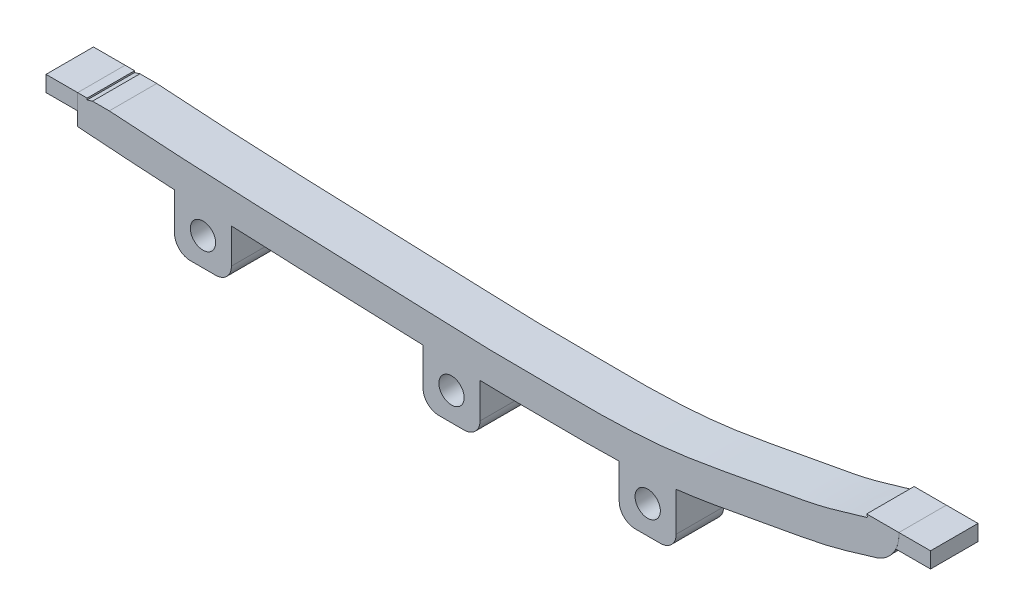
from build123d import *

# Parameters (mm, degrees)
BOSS_EXTRUDE4_DEPTH   = 15
BOSS_EXTRUDE6_DEPTH   = 15
SKETCH9_W             = 10
SKETCH9_H             = 5
BOSS_EXTRUDE6_2_DEPTH = 15
BOSS_EXTRUDE7_DEPTH   = 15
SKETCH10_3_R          = 4
BOSS_EXTRUDE8_DEPTH   = 15


with BuildPart() as part:
    # Sketch7 → Boss-Extrude4 (new body)
    with BuildSketch(Plane(origin=(0, 0, -6), x_dir=(-1, 0, 0), z_dir=(0, 0, -1))):
        with BuildLine():
            add(Edge.make_bspline(
                [(57.2, -13.241438652), (57.940948653, -13.346356469), (64.587142125, -14.249582963), (71.312194486, -14.734985078), (77.511230388, -14.988343975), (78.2, -15.01379053)],
                knots=[0.238034992, 0.238034992, 0.238034992, 0.238034992, 0.246275151, 0.312196429, 0.320436589, 0.320436589, 0.320436589, 0.320436589], degree=3))
            add(Edge.make_bspline(
                [(34.2, -9.211877556), (41.409801763, -10.527206877), (48.791618696, -12.006313762), (56.437988852, -13.1335384), (57.2, -13.241438652)],
                knots=[0.153291014, 0.153291014, 0.153291014, 0.153291014, 0.229560594, 0.238034992, 0.238034992, 0.238034992, 0.238034992], degree=3))
            add(Edge.make_bspline(
                [(10.85, -4.486121303), (11.496747196, -4.663742615), (18.016097792, -6.397161892), (26.844120594, -7.869898375), (34.2, -9.211877556)],
                knots=[0.066830041, 0.066830041, 0.066830041, 0.066830041, 0.075476139, 0.153291014, 0.153291014, 0.153291014, 0.153291014], degree=3))
            add(Edge.make_bspline(
                [(0, -0.35), (-0.483452752, -1.204257993), (1.302042991, -1.648175028), (6.582551453, -3.291551277), (10.421202726, -4.368357307), (10.85, -4.486121303)],
                knots=[0, 0, 0, 0, 0.015238311, 0.061097627, 0.066830041, 0.066830041, 0.066830041, 0.066830041], degree=3))
            Line((0, -0.35), (-10.188216911, -0.35))
            add(Edge.make_bspline(
                [(-10.188216911, -0.35), (-10.197127097, -0.510752936), (-10.216331299, -1.088262475), (-10.151417384, -2.435265781), (-9.675954224, -4.523313959), (-8.530561998, -6.760194321), (-7.075801045, -8.452525785), (-5.679238644, -9.553961654), (-4.134605623, -10.44231148), (-2.880886158, -10.899353539), (-2.150247131, -11.108080139), (-1.99097397, -11.151191222), (-1.743295207, -11.221598169), (-1.397756261, -11.320747763), (-0.898863104, -11.466275116), (-0.223591276, -11.66586298), (0.519660501, -11.887231791), (1.31921711, -12.126191555), (2.448276504, -12.463649443), (3.954159506, -12.911953065), (5.85344771, -13.467978987), (7.76640741, -14.013306986), (9.765908185, -14.555389572), (12.628699413, -15.264549802), (16.351645079, -16.077455835), (21.025045558, -16.990630025), (25.780594099, -17.859563119), (30.50545011, -18.701614623), (35.035354382, -19.530251144), (39.492904564, -20.367600229), (45.401537623, -21.465593589), (51.344923032, -22.501474122), (57.523606347, -23.398956772), (63.56627511, -24.122790279), (69.296485447, -24.591214113), (74.906141504, -24.893682219), (79.129467052, -25.063967779), (83.372818136, -25.161769493), (88.887878389, -25.205095957), (95.617379104, -25.150845956), (103.427870642, -25.090659436), (111.416956976, -25.083478463), (119.66653005, -24.981964106), (127.964146322, -24.706890196), (136.060643619, -24.393165499), (146.702723915, -24.003393297), (159.76888755, -23.534872407), (175.126965002, -22.976435331), (195.267726209, -22.189784525), (215.031454717, -21.270031239), (232.227098133, -20.238260428), (242.049294314, -19.554945574), (246.912434987, -19.212388667), (249.35, -19.041222648)],
                knots=[0.004195794, 0.004195794, 0.004195794, 0.004195794, 0.004450038, 0.005084888, 0.006101866, 0.007118844, 0.008135822, 0.009152799, 0.010169777, 0.012203732, 0.014237688, 0.016271643, 0.018305599, 0.020339554, 0.024407465, 0.028475376, 0.032543286, 0.036611197, 0.040679108, 0.048814929, 0.056950751, 0.065086573, 0.073222394, 0.081358216, 0.097629859, 0.113901502, 0.130173145, 0.146444788, 0.162716432, 0.178988075, 0.195259718, 0.227803004, 0.244074647, 0.260346291, 0.292889577, 0.30916122, 0.325432863, 0.341704506, 0.35797615, 0.390519436, 0.423062722, 0.455606009, 0.488149295, 0.520692581, 0.553235868, 0.585779154, 0.650865727, 0.715952299, 0.781038872, 0.911212017, 0.97629859, 1.008841876, 1.041385163, 1.041385163, 1.041385163, 1.041385163], degree=3))
            Line((249.35, -19.041222648), (249.35, -10.422260297))
            Line((249.35, -10.422260297), (249.35, -9.718799499))
            Line((249.35, -9.718799499), (246.35, -9.718799499))
            Line((246.35, -9.718799499), (246.35, -10.231818509))
            add(Edge.make_bspline(
                [(244.655582362, -9.718799499), (245.221025629, -9.887119027), (245.785839725, -10.058090244), (246.35, -10.231818509)],
                knots=[0.848733006, 0.848733006, 0.848733006, 0.848733006, 0.858409316, 0.858409316, 0.858409316, 0.858409316], degree=3))
            Line((244.655582362, -9.718799499), (239.35, -9.718799499))
            add(Edge.make_bspline(
                [(120.2, -14.937565102), (124.42621276, -14.832580639), (167.021385075, -13.178620512), (205.049851795, -12.127358768), (239.35, -9.718799499)],
                knots=[0.491186429, 0.491186429, 0.491186429, 0.491186429, 0.542067786, 1, 1, 1, 1], degree=3))
            add(Edge.make_bspline(
                [(100.2, -15.114678663), (106.147715502, -15.0776097), (112.777403417, -15.106727027), (119.524444871, -14.954346744), (120.2, -14.937565102)],
                knots=[0.409853179, 0.409853179, 0.409853179, 0.409853179, 0.483053104, 0.491186429, 0.491186429, 0.491186429, 0.491186429], degree=3))
            add(Edge.make_bspline(
                [(78.2, -15.01379053), (78.947405775, -15.041403394), (86.421320399, -15.285687036), (93.661168244, -15.155431741), (100.2, -15.114678663)],
                knots=[0.320436589, 0.320436589, 0.320436589, 0.320436589, 0.329378248, 0.409853179, 0.409853179, 0.409853179, 0.409853179], degree=3))
        make_face()
    extrude(amount=BOSS_EXTRUDE4_DEPTH)

    # Sketch10 → Boss-Extrude7 (add)
    with BuildSketch(Plane.XY.offset(-6)):
        with BuildLine():
            add(Edge.make_bspline(
                [(-60.2, -23.714449378), (-60.813781821, -23.786710968), (-64.414348052, -24.192117154), (-69.296485447, -24.591214113), (-74.596964487, -24.877011645), (-77.101104267, -24.981720215), (-78.2, -25.020602765)],
                knots=[0.253707481, 0.253707481, 0.253707481, 0.253707481, 0.260346291, 0.292889577, 0.30916122, 0.321845607, 0.321845607, 0.321845607, 0.321845607], degree=3))
            Line((-78.2, -25.020602765), (-78.2, -36.01379053))
            ThreePointArc((-78.2, -36.01379053), (-76.735533906, -39.549324436), (-73.2, -41.01379053))
            Line((-73.2, -41.01379053), (-69.2, -41.01379053))
            Line((-69.2, -41.01379053), (-65.2, -41.01379053))
            ThreePointArc((-65.2, -41.01379053), (-61.664466094, -39.549324436), (-60.2, -36.01379053))
            Line((-60.2, -36.01379053), (-60.2, -23.714449378))
        make_face()
        with BuildLine():
            ThreePointArc((-65.2, -32.148166032), (-66.371572875, -34.976593157), (-69.2, -36.148166032))
            ThreePointArc((-69.2, -36.148166032), (-72.028427125, -29.319738908), (-65.2, -32.148166032))
        make_face(mode=Mode.SUBTRACT)
    extrude(amount=-BOSS_EXTRUDE7_DEPTH)

    # Sketch10<3> → Boss-Extrude8 (add)
    # profile 1 of 3: a face of its own
    with BuildSketch(Plane.XY.offset(-6)):
        with BuildLine():
            Line((-78.2, -15.01379053), (-78.2, -36.01379053))
            ThreePointArc((-78.2, -36.01379053), (-76.735533906, -39.549324436), (-73.2, -41.01379053))
            Line((-73.2, -41.01379053), (-65.2, -41.01379053))
            ThreePointArc((-65.2, -41.01379053), (-61.664466094, -39.549324436), (-60.2, -36.01379053))
            Line((-60.2, -36.01379053), (-60.2, -15.01379053))
            Line((-60.2, -15.01379053), (-78.2, -15.01379053))
        make_face()
        with Locations((-69.2, -32.148166032)):
            Circle(SKETCH10_3_R, mode=Mode.SUBTRACT)
    # profile 2 of 3: a face of its own
    with BuildSketch(Plane.XY.offset(-6)):
        with BuildLine():
            Line((-122.2, -15.01379053), (-140.2, -15.01379053))
            Line((-140.2, -15.01379053), (-140.2, -36.01379053))
            ThreePointArc((-140.2, -36.01379053), (-138.735533906, -39.549324436), (-135.2, -41.01379053))
            Line((-135.2, -41.01379053), (-127.2, -41.01379053))
            ThreePointArc((-127.2, -41.01379053), (-123.664466094, -39.549324436), (-122.2, -36.01379053))
            Line((-122.2, -36.01379053), (-122.2, -15.01379053))
        make_face()
        with Locations((-131.2, -32.148166032)):
            Circle(SKETCH10_3_R, mode=Mode.SUBTRACT)
    # profile 3 of 3: a face of its own
    with BuildSketch(Plane.XY.offset(-6)):
        with BuildLine():
            Line((-200.745146796, -11.907469769), (-218.745146796, -11.907469769))
            Line((-218.745146796, -11.907469769), (-218.745146796, -32.907469769))
            ThreePointArc((-218.745146796, -32.907469769), (-217.280680702, -36.443003675), (-213.745146796, -37.907469769))
            Line((-213.745146796, -37.907469769), (-205.745146796, -37.907469769))
            ThreePointArc((-205.745146796, -37.907469769), (-202.20961289, -36.443003675), (-200.745146796, -32.907469769))
            Line((-200.745146796, -32.907469769), (-200.745146796, -11.907469769))
        make_face()
        with Locations((-209.745146796, -29.041845272)):
            Circle(SKETCH10_3_R, mode=Mode.SUBTRACT)
    extrude(amount=-BOSS_EXTRUDE8_DEPTH)


with BuildPart() as body_2:
    # Sketch9 → Boss-Extrude6 (new body)
    with BuildSketch(Plane.XY.offset(-6)):
        with BuildLine():
            Line((20.188216911, -0.35), (10.188216911, -0.35))
            add(Edge.make_bspline(
                [(10.188216911, -0.35), (10.197127097, -0.510752936), (10.216331299, -1.088262475), (10.151417384, -2.435265781), (9.789293569, -4.0255719), (9.350780851, -5.07190588), (9.219811917, -5.35)],
                knots=[0.004195794, 0.004195794, 0.004195794, 0.004195794, 0.004450038, 0.005084888, 0.006101866, 0.006482663, 0.006482663, 0.006482663, 0.006482663], degree=3))
            Line((9.219811917, -5.35), (20.188216911, -5.35))
            Line((20.188216911, -5.35), (20.188216911, -0.35))
        make_face()
    extrude(amount=-BOSS_EXTRUDE6_DEPTH)


with BuildPart() as body_3:
    # Sketch9 → Boss-Extrude6 2 (new body)
    with BuildSketch(Plane.XY.offset(-6)):
        with Locations((-254.35, -12.218799499)):
            Rectangle(SKETCH9_W, SKETCH9_H)
    extrude(amount=-BOSS_EXTRUDE6_2_DEPTH)


solid = Compound([part.part, body_2.part, body_3.part])
